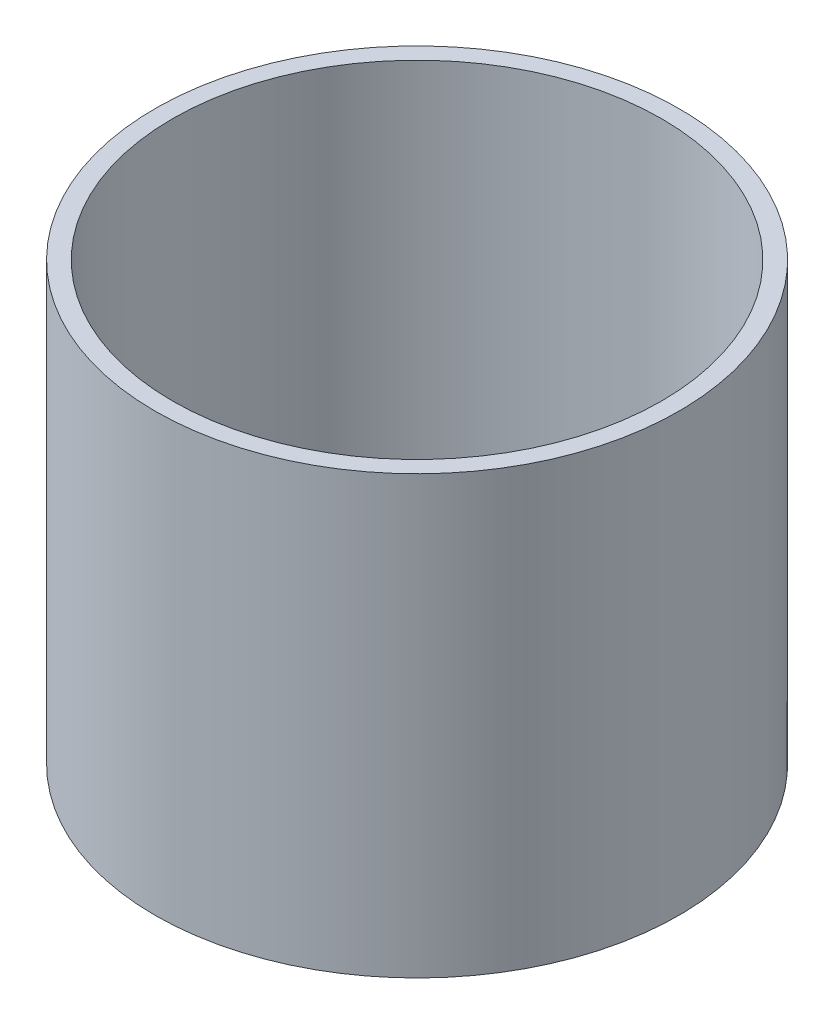
from build123d import *

# Parameters (mm, degrees)
SKETCH1_R           = 30
SKETCH1_R_2         = 28
BOSS_EXTRUDE1_DEPTH = 50


with BuildPart() as part:
    # Sketch1 → Boss-Extrude1 (new body)
    with BuildSketch(Plane(origin=(0, 0, 0), x_dir=(1, 0, 0), z_dir=(0, 1, 0))):
        with Locations(Location((0, 0, 0), (0, 0, 270))):
            Circle(SKETCH1_R)
        with Locations(Location((0, 0, 0), (0, 0, 270))):
            Circle(SKETCH1_R_2, mode=Mode.SUBTRACT)
    extrude(amount=BOSS_EXTRUDE1_DEPTH)


solid = part.part
